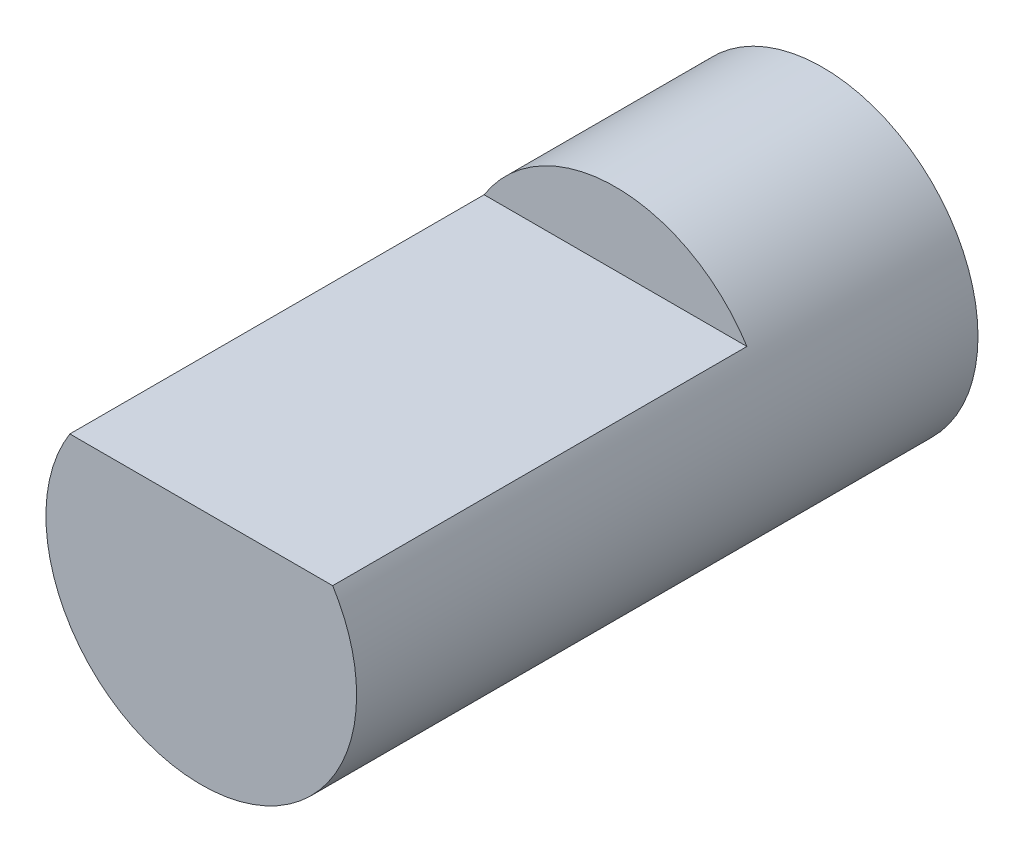
from build123d import *

# Parameters (mm, degrees)
SKETCH1_R           = 7.5
BOSS_EXTRUDE1_DEPTH = 30
CUT_EXTRUDE1_DEPTH  = 20


with BuildPart() as part:
    # Sketch1 → Boss-Extrude1 (new body)
    with BuildSketch(Plane.XY):
        Circle(SKETCH1_R)
    extrude(amount=-BOSS_EXTRUDE1_DEPTH)

    # Sketch2 → Cut-Extrude1 (cut)
    with BuildSketch(Plane.XY):
        with BuildLine():
            Line((-6.34428877, 4), (6.34428877, 4))
            ThreePointArc((6.34428877, 4), (0, 7.5), (-6.34428877, 4))
        make_face()
    extrude(amount=-CUT_EXTRUDE1_DEPTH, mode=Mode.SUBTRACT)


solid = part.part
